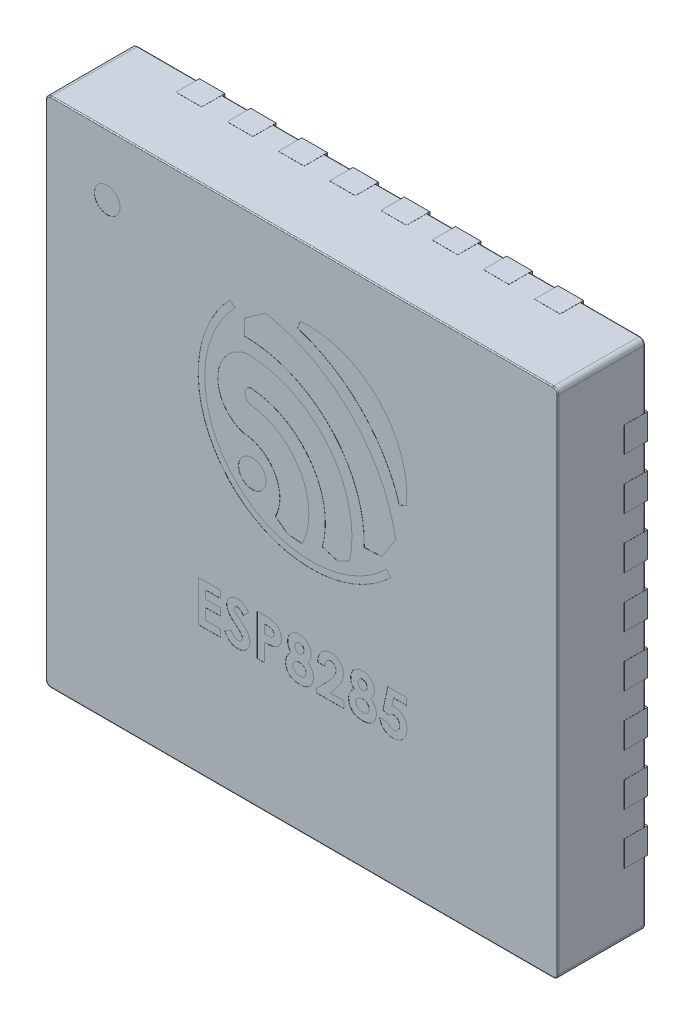
from build123d import *

# Parameters (mm, degrees)
SKETCH1_W                = 5
SKETCH1_H                = 5
BOSS_EXTRUDE1_DEPTH      = 0.85
FILLET1_R                = 0.05
FILLET2_R                = 0.01
BOSS_EXTRUDE2_DEPTH      = 0.025
BOSS_EXTRUDE2_DEPTH_BACK = 0.203
SKETCH2_W                = 0.25
SKETCH2_H                = 0.4
SKETCH2_W_2              = 0.4
SKETCH2_H_2              = 0.25
SKETCH3_R                = 0.125
SKETCH3_R_2              = 0.134340001
CUT_EXTRUDE1_DEPTH       = 0.001
BODY_MOVE_COPY1_ANGLE    = 180


with BuildPart() as part:
    # Sketch1 → Boss-Extrude1 (new body)
    with BuildSketch(Plane(origin=(0, 0, 0), x_dir=(1, 0, 0), z_dir=(0, 1, 0))):
        Rectangle(SKETCH1_W, SKETCH1_H)
    extrude(amount=BOSS_EXTRUDE1_DEPTH)

    # Fillet1
    fillet1_edges = [part.edges().sort_by_distance(p)[0] for p in [
        (2.5, 0.425, 2.5),
        (-2.5, 0.425, 2.5),
        (-2.5, 0.425, -2.5),
        (2.5, 0.425, -2.5),
    ]]
    fillet(fillet1_edges, radius=FILLET1_R)

    # Fillet2
    fillet2_edges = [part.edges().sort_by_distance(p)[0] for p in [
        (0, 0, -2.5),
        (0, 0.85, -2.5),
        (2.5, 0, 0),
        (0, 0, 2.5),
        (-2.5, 0, 0),
        (-2.485355339, 0, -2.485355339),
        (-2.485355339, 0, 2.485355339),
        (2.485355339, 0, 2.485355339),
        (2.485355339, 0, -2.485355339),
        (2.5, 0.85, 0),
        (-2.5, 0.85, 0),
        (0, 0.85, 2.5),
        (-2.485355339, 0.85, -2.485355339),
        (-2.485355339, 0.85, 2.485355339),
        (2.485355339, 0.85, 2.485355339),
        (2.485355339, 0.85, -2.485355339),
    ]]
    fillet(fillet2_edges, radius=FILLET2_R)

    # Sketch2 → Boss-Extrude2 (add, two sides: drawn at the far end of the back side and taken through both)
    with BuildSketch(Plane.XZ.offset(-BOSS_EXTRUDE2_DEPTH_BACK)):
        with BuildLine():
            Line((1.55, 1.85), (1.85, 1.55))
            Line((1.85, 1.55), (1.85, -1.8))
            ThreePointArc((1.85, -1.8), (1.835355339, -1.835355339), (1.8, -1.85))
            Line((1.8, -1.85), (-1.8, -1.85))
            ThreePointArc((-1.8, -1.85), (-1.835355339, -1.835355339), (-1.85, -1.8))
            Line((-1.85, -1.8), (-1.85, 1.8))
            ThreePointArc((-1.85, 1.8), (-1.835355339, 1.835355339), (-1.8, 1.85))
            Line((-1.8, 1.85), (1.55, 1.85))
        make_face()
        with Locations((-0.25, 2.301)):
            Rectangle(SKETCH2_W, SKETCH2_H)
        with Locations((-0.75, 2.301)):
            Rectangle(SKETCH2_W, SKETCH2_H)
        with Locations((-1.25, 2.301)):
            Rectangle(SKETCH2_W, SKETCH2_H)
        with Locations((-1.75, 2.301)):
            Rectangle(SKETCH2_W, SKETCH2_H)
        with Locations((1.75, 2.301)):
            Rectangle(SKETCH2_W, SKETCH2_H)
        with Locations((1.25, 2.301)):
            Rectangle(SKETCH2_W, SKETCH2_H)
        with Locations((0.75, 2.301)):
            Rectangle(SKETCH2_W, SKETCH2_H)
        with Locations((0.25, 2.301)):
            Rectangle(SKETCH2_W, SKETCH2_H)
        with Locations((0.25, -2.301)):
            Rectangle(SKETCH2_W, SKETCH2_H)
        with Locations((0.75, -2.301)):
            Rectangle(SKETCH2_W, SKETCH2_H)
        with Locations((1.25, -2.301)):
            Rectangle(SKETCH2_W, SKETCH2_H)
        with Locations((1.75, -2.301)):
            Rectangle(SKETCH2_W, SKETCH2_H)
        with Locations((-1.75, -2.301)):
            Rectangle(SKETCH2_W, SKETCH2_H)
        with Locations((-1.25, -2.301)):
            Rectangle(SKETCH2_W, SKETCH2_H)
        with Locations((-0.75, -2.301)):
            Rectangle(SKETCH2_W, SKETCH2_H)
        with Locations((-0.25, -2.301)):
            Rectangle(SKETCH2_W, SKETCH2_H)
        with Locations((2.301, 0.25)):
            Rectangle(SKETCH2_W_2, SKETCH2_H_2)
        with Locations((2.301, 0.75)):
            Rectangle(SKETCH2_W_2, SKETCH2_H_2)
        with Locations((2.301, 1.25)):
            Rectangle(SKETCH2_W_2, SKETCH2_H_2)
        with Locations((2.301, 1.75)):
            Rectangle(SKETCH2_W_2, SKETCH2_H_2)
        with Locations((2.301, -1.75)):
            Rectangle(SKETCH2_W_2, SKETCH2_H_2)
        with Locations((2.301, -1.25)):
            Rectangle(SKETCH2_W_2, SKETCH2_H_2)
        with Locations((2.301, -0.75)):
            Rectangle(SKETCH2_W_2, SKETCH2_H_2)
        with Locations((2.301, -0.25)):
            Rectangle(SKETCH2_W_2, SKETCH2_H_2)
        with Locations((-2.301, -0.25)):
            Rectangle(SKETCH2_W_2, SKETCH2_H_2)
        with Locations((-2.301, -0.75)):
            Rectangle(SKETCH2_W_2, SKETCH2_H_2)
        with Locations((-2.301, -1.25)):
            Rectangle(SKETCH2_W_2, SKETCH2_H_2)
        with Locations((-2.301, -1.75)):
            Rectangle(SKETCH2_W_2, SKETCH2_H_2)
        with Locations((-2.301, 1.75)):
            Rectangle(SKETCH2_W_2, SKETCH2_H_2)
        with Locations((-2.301, 1.25)):
            Rectangle(SKETCH2_W_2, SKETCH2_H_2)
        with Locations((-2.301, 0.75)):
            Rectangle(SKETCH2_W_2, SKETCH2_H_2)
        with Locations((-2.301, 0.25)):
            Rectangle(SKETCH2_W_2, SKETCH2_H_2)
    extrude(amount=BOSS_EXTRUDE2_DEPTH + BOSS_EXTRUDE2_DEPTH_BACK)

    # Sketch3 → Cut-Extrude1 (cut)
    # profile 1 of 13: a face of its own
    with BuildSketch(Plane(origin=(0, 0.85, 0), x_dir=(1, 0, 0), z_dir=(0, 1, 0))):
        with Locations(Location((1.9, -1.9, 0), (0, 0, 270))):
            Circle(SKETCH3_R)
    # profile 2 of 13: a face of its own
    with BuildSketch(Plane(origin=(0, 0.85, 0), x_dir=(1, 0, 0), z_dir=(0, 1, 0))):
        with Locations(Location((0.483594139, -0.295042575, 0), (0, 0, 270))):
            Circle(SKETCH3_R_2)
    # profile 3 of 13: a face of its own
    with BuildSketch(Plane(origin=(0, 0.85, 0), x_dir=(1, 0, 0), z_dir=(0, 1, 0))):
        with BuildLine():
            Line((-0.951785861, -0.747131021), (-1.020815861, -0.776531021))
            ThreePointArc((-1.020815861, -0.776531021), (-0.744879335, -1.538615836), (0.015772809, -1.818477493))
            Line((0.015772809, -1.818477493), (0.042084139, -1.745141021))
            ThreePointArc((0.042084139, -1.745141021), (-0.579273267, -1.370042291), (-0.951785861, -0.747131021))
        make_face()
    # profile 4 of 13: a face of its own
    with BuildSketch(Plane(origin=(0, 0.85, 0), x_dir=(1, 0, 0), z_dir=(0, 1, 0))):
        with BuildLine():
            Line((-0.608885862, -0.217240217), (-0.779015862, -0.224530217))
            Line((-0.779015862, -0.224530217), (-0.916505862, -0.434440217))
            ThreePointArc((-0.916505862, -0.434440217), (-0.482429799, -1.275536784), (0.355366094, -1.715949664))
            Line((0.355366094, -1.715949664), (0.561766094, -1.571139664))
            Line((0.561766094, -1.571139664), (0.561766094, -1.419009664))
            ThreePointArc((0.561766094, -1.419009664), (-0.277433802, -1.065425286), (-0.608885862, -0.217240217))
        make_face()
    # profile 5 of 13: a face of its own
    with BuildSketch(Plane(origin=(0, 0.85, 0), x_dir=(1, 0, 0), z_dir=(0, 1, 0))):
        with BuildLine():
            Line((0.652194139, -1.611641021), (0.700284139, -1.654181021))
            ThreePointArc((0.700284139, -1.654181021), (0.685311706, -0.099263955), (-0.869668762, -0.094067666))
            Line((-0.869668762, -0.094067666), (-0.826901773, -0.141962742))
            ThreePointArc((-0.826901773, -0.141962742), (0.64006638, -0.144720408), (0.652194139, -1.611641021))
        make_face()
    # profile 6 of 13: a face of its own
    with BuildSketch(Plane(origin=(0, 0.85, 0), x_dir=(1, 0, 0), z_dir=(0, 1, 0))):
        with BuildLine():
            Line((0.257726542, -0.047166837), (0.139346542, 0.042413163))
            Line((0.139346542, 0.042413163), (-0.002793458, 0.054923163))
            ThreePointArc((-0.002793458, 0.054923163), (0.010161928, -0.539574072), (0.504116848, -0.870638026))
            ThreePointArc((0.504116848, -0.870638026), (0.554404737, -0.94213728), (0.501462863, -1.011694256))
            ThreePointArc((0.501462863, -1.011694256), (-0.086844469, -0.682432252), (-0.198992375, -0.017645195))
            Line((-0.198992375, -0.017645195), (-0.349232375, 0.027084805))
            Line((-0.349232375, 0.027084805), (-0.466280352, -0.031499116))
            ThreePointArc((-0.466280352, -0.031499116), (-0.259791749, -0.898754897), (0.544527625, -1.283255195))
            ThreePointArc((0.544527625, -1.283255195), (0.820500189, -0.950984657), (0.574016431, -0.596287147))
            ThreePointArc((0.574016431, -0.596287147), (0.26490491, -0.408682802), (0.257726542, -0.047166837))
        make_face()
    # profile 7 of 13: a face of its own
    with BuildSketch(Plane(origin=(0, 0.85, 0), x_dir=(1, 0, 0), z_dir=(0, 1, 0))):
        with BuildLine():
            Line((-0.83838141, 0.845), (-1.020512821, 0.845))
            Line((-1.020512821, 0.845), (-1.020512821, 0.911666667))
            Line((-1.020512821, 0.911666667), (-0.895272436, 0.911666667))
            Line((-0.895272436, 0.911666667), (-0.879647436, 0.987307692))
            add(Edge.make_bspline(
                [(-0.879647436, 0.987307692), (-0.88177626, 0.986712941), (-0.886000031, 0.985532903), (-0.892330873, 0.984388808), (-0.898458165, 0.983606591), (-0.902454988, 0.983509136), (-0.904407051, 0.983461538)],
                knots=[0, 0, 0, 0, 1.054652254, 2.092520994, 3.068380062, 4, 4, 4, 4], degree=3))
            add(Edge.make_bspline(
                [(-0.904407051, 0.983461538), (-0.908660347, 0.983559), (-0.91704453, 0.983751119), (-0.929309526, 0.985574952), (-0.941053983, 0.988447434), (-0.952241964, 0.992544185), (-0.962862539, 0.997876214), (-0.972928581, 1.004326473), (-0.982452446, 1.011906292), (-0.991264949, 1.020620418), (-0.999362245, 1.030188725), (-1.006402382, 1.040537861), (-1.012415099, 1.051520258), (-1.017197406, 1.063204183), (-1.02097201, 1.075516251), (-1.023699623, 1.088464354), (-1.025312597, 1.102063837), (-1.025530097, 1.111341792), (-1.025641026, 1.116073718)],
                knots=[0, 0, 0, 0, 1.01440847, 1.999622559, 2.951875003, 3.895578053, 4.836219714, 5.782137149, 6.743708247, 7.735272588, 8.734977101, 9.730283169, 10.717124674, 11.717316708, 12.737475749, 13.78628267, 14.87096371, 16, 16, 16, 16], degree=3))
            add(Edge.make_bspline(
                [(-1.025641026, 1.116073718), (-1.025506164, 1.1208596), (-1.025240043, 1.130303544), (-1.023484912, 1.144185388), (-1.020439256, 1.15750513), (-1.016082444, 1.170182129), (-1.010584492, 1.182309229), (-1.003949103, 1.193901185), (-0.995927975, 1.204828892), (-0.98684947, 1.215087044), (-0.976943946, 1.224470899), (-0.966369862, 1.232704055), (-0.95530596, 1.239754789), (-0.943595375, 1.245346854), (-0.931417287, 1.249793468), (-0.9187294, 1.253023543), (-0.905476992, 1.254877383), (-0.89648007, 1.25512868), (-0.891907051, 1.25525641)],
                knots=[0, 0, 0, 0, 1.068252361, 2.107974174, 3.117445057, 4.112928197, 5.094821713, 6.085741881, 7.08864209, 8.115013732, 9.139860459, 10.12970393, 11.102304324, 12.062250553, 13.020362151, 13.992066755, 14.979393365, 16, 16, 16, 16], degree=3))
            add(Edge.make_bspline(
                [(-0.891907051, 1.25525641), (-0.887818349, 1.255148471), (-0.879754573, 1.254935592), (-0.867858065, 1.253717076), (-0.856448403, 1.251297116), (-0.845413093, 1.248258926), (-0.834904708, 1.244070952), (-0.824706707, 1.23925828), (-0.815126084, 1.233216062), (-0.805890658, 1.226559679), (-0.797355469, 1.219000087), (-0.789430795, 1.210831225), (-0.782418084, 1.201900397), (-0.776056067, 1.192381181), (-0.770690412, 1.182095836), (-0.765893828, 1.171229372), (-0.761975299, 1.159659475), (-0.759985537, 1.151639686), (-0.758974359, 1.147564103)],
                knots=[0, 0, 0, 0, 1.055144606, 2.080965977, 3.079696235, 4.061281178, 5.030010203, 5.994686618, 6.966205752, 7.947572972, 8.929036963, 9.903776773, 10.879904045, 11.854643856, 12.853445432, 13.868704235, 14.916895142, 16, 16, 16, 16], degree=3))
            Line((-0.758974359, 1.147564103), (-0.841025641, 1.147564103))
            add(Edge.make_bspline(
                [(-0.841025641, 1.147564103), (-0.842524814, 1.150389398), (-0.845438284, 1.155880036), (-0.850993058, 1.163153038), (-0.857167865, 1.169421519), (-0.864126829, 1.174451051), (-0.871500355, 1.17848231), (-0.879304513, 1.181440187), (-0.887533098, 1.183139553), (-0.893154795, 1.183353501), (-0.89599359, 1.183461538)],
                knots=[0, 0, 0, 0, 1.105237818, 2.14790357, 3.154462025, 4.139874369, 5.10774607, 6.055457142, 7.018062016, 8, 8, 8, 8], degree=3))
            add(Edge.make_bspline(
                [(-0.89599359, 1.183461538), (-0.897972124, 1.183387072), (-0.901864924, 1.183240559), (-0.907600617, 1.182466057), (-0.91307455, 1.180997261), (-0.918332354, 1.178969732), (-0.923389632, 1.176407603), (-0.928220909, 1.173259588), (-0.932801971, 1.169545491), (-0.937117552, 1.165325461), (-0.941012783, 1.160608844), (-0.944458338, 1.15557385), (-0.9474058, 1.150224864), (-0.949696857, 1.144502914), (-0.951545672, 1.138471607), (-0.952915247, 1.13212335), (-0.95373179, 1.125443552), (-0.953807522, 1.12088372), (-0.953846154, 1.118557692)],
                knots=[0, 0, 0, 0, 0.978584799, 1.925382083, 2.854237347, 3.773848163, 4.706917643, 5.651871472, 6.619075428, 7.618203006, 8.630937754, 9.638147826, 10.630884984, 11.643619732, 12.679505692, 13.746568031, 14.850495961, 16, 16, 16, 16], degree=3))
            add(Edge.make_bspline(
                [(-0.953846154, 1.118557692), (-0.953813736, 1.116283922), (-0.953750588, 1.111854822), (-0.952857302, 1.105386754), (-0.951737945, 1.099194807), (-0.949928463, 1.093336926), (-0.947720773, 1.087747649), (-0.944834581, 1.082556685), (-0.941701748, 1.077525758), (-0.937885843, 1.073021272), (-0.933854546, 1.068850044), (-0.929504374, 1.065222008), (-0.924931675, 1.062167843), (-0.920141235, 1.059672883), (-0.915177905, 1.057605605), (-0.909929455, 1.056320813), (-0.904523634, 1.055340153), (-0.90083276, 1.055284615), (-0.898958333, 1.05525641)],
                knots=[0, 0, 0, 0, 1.166510573, 2.272258428, 3.34817395, 4.393855846, 5.415148486, 6.427654656, 7.43960333, 8.452852352, 9.451798603, 10.415864797, 11.355425197, 12.269514664, 13.186377996, 14.107845883, 15.039060727, 16, 16, 16, 16], degree=3))
            add(Edge.make_bspline(
                [(-0.898958333, 1.05525641), (-0.896921904, 1.055331554), (-0.892840464, 1.055482158), (-0.886797515, 1.056771985), (-0.880774145, 1.058681063), (-0.874848715, 1.061531644), (-0.868965498, 1.0651891), (-0.863114367, 1.069607945), (-0.85731899, 1.074858809), (-0.853657188, 1.078785767), (-0.851762821, 1.080817308)],
                knots=[0, 0, 0, 0, 0.882519632, 1.768758668, 2.670168731, 3.618680561, 4.612333577, 5.671392632, 6.795336641, 8, 8, 8, 8], degree=3))
            Line((-0.851762821, 1.080817308), (-0.791346154, 1.066955128))
            Line((-0.791346154, 1.066955128), (-0.83838141, 0.845))
        make_face()
    # profile 8 of 13: a face of its own
    with BuildSketch(Plane(origin=(0, 0.85, 0), x_dir=(1, 0, 0), z_dir=(0, 1, 0))):
        with BuildLine():
            add(Edge.make_bspline(
                [(-0.673397436, 1.029615385), (-0.677592676, 1.032611819), (-0.685896776, 1.038542989), (-0.696835756, 1.049166136), (-0.706319304, 1.060978078), (-0.714210884, 1.073940436), (-0.720515406, 1.087813959), (-0.724848014, 1.102411983), (-0.727745214, 1.117508649), (-0.728050699, 1.127785556), (-0.728205128, 1.132980769)],
                knots=[0, 0, 0, 0, 1.013470425, 2.00607327, 2.989559212, 3.987547927, 4.985093546, 5.979490292, 6.978585884, 8, 8, 8, 8], degree=3))
            add(Edge.make_bspline(
                [(-0.728205128, 1.132980769), (-0.728015488, 1.138605423), (-0.727639362, 1.149761203), (-0.72430566, 1.166119166), (-0.71898142, 1.181819559), (-0.711636537, 1.196676855), (-0.702469997, 1.210281748), (-0.69184817, 1.222422273), (-0.679612501, 1.232562724), (-0.668312397, 1.239541116), (-0.658518136, 1.244068465), (-0.650677926, 1.247159249), (-0.642264081, 1.249595539), (-0.633416974, 1.251691005), (-0.624044292, 1.253262057), (-0.614238307, 1.254498783), (-0.603907086, 1.255098542), (-0.596875572, 1.255202891), (-0.593269231, 1.25525641)],
                knots=[0, 0, 0, 0, 1.313633616, 2.605423678, 3.884827599, 5.180399172, 6.467003699, 7.709825993, 8.937691468, 10.168030689, 10.802071053, 11.45831639, 12.135866991, 12.84764728, 13.582572811, 14.35620613, 15.156926628, 16, 16, 16, 16], degree=3))
            add(Edge.make_bspline(
                [(-0.593269231, 1.25525641), (-0.589422446, 1.255203935), (-0.581910435, 1.255101461), (-0.570943405, 1.254489406), (-0.560602554, 1.253339218), (-0.550841027, 1.251892113), (-0.541748344, 1.249743212), (-0.533203708, 1.247407034), (-0.525299549, 1.244504849), (-0.515637693, 1.240028681), (-0.504438182, 1.233334421), (-0.492485395, 1.223326268), (-0.481835419, 1.211591801), (-0.47291586, 1.198046978), (-0.465483483, 1.183267583), (-0.460179218, 1.167327916), (-0.456984356, 1.150443239), (-0.456603901, 1.138870869), (-0.456410256, 1.132980769)],
                knots=[0, 0, 0, 0, 0.887187828, 1.732502891, 2.531768656, 3.28622382, 4.00645991, 4.68503301, 5.328123524, 5.945476897, 7.13918604, 8.324554323, 9.528234031, 10.780485522, 12.053158567, 13.332907357, 14.642504384, 16, 16, 16, 16], degree=3))
            add(Edge.make_bspline(
                [(-0.456410256, 1.132980769), (-0.456542381, 1.1278403), (-0.456802174, 1.11773271), (-0.459504282, 1.102980157), (-0.463624036, 1.088870262), (-0.469645079, 1.075532904), (-0.477204439, 1.062806695), (-0.486620249, 1.050952752), (-0.497571185, 1.039680894), (-0.505904888, 1.033026207), (-0.510176282, 1.029615385)],
                knots=[0, 0, 0, 0, 1.017680362, 2.001042016, 2.962316111, 3.924347734, 4.892953533, 5.888308623, 6.917664266, 8, 8, 8, 8], degree=3))
            add(Edge.make_bspline(
                [(-0.510176282, 1.029615385), (-0.507528109, 1.026562761), (-0.502314655, 1.020553065), (-0.495585881, 1.010872929), (-0.489843763, 1.00091206), (-0.485210311, 0.99061154), (-0.481484993, 0.980090117), (-0.47880531, 0.969283041), (-0.477281406, 0.958157926), (-0.477043329, 0.950640164), (-0.476923077, 0.946842949)],
                knots=[0, 0, 0, 0, 1.06167017, 2.090108827, 3.093337593, 4.079993162, 5.054811602, 6.023746282, 7.001795783, 8, 8, 8, 8], degree=3))
            add(Edge.make_bspline(
                [(-0.476923077, 0.946842949), (-0.477081268, 0.941702255), (-0.477393373, 0.931559864), (-0.480208687, 0.916714316), (-0.484778775, 0.902558838), (-0.491226001, 0.889279591), (-0.499159864, 0.877001848), (-0.508764714, 0.866148286), (-0.519757362, 0.856664209), (-0.532202452, 0.848746049), (-0.545880528, 0.842489072), (-0.560641334, 0.837991374), (-0.576416771, 0.835199163), (-0.587301225, 0.834897758), (-0.59286859, 0.83474359)],
                knots=[0, 0, 0, 0, 1.022461855, 2.017277858, 2.995792987, 3.975491763, 4.947267477, 5.896545572, 6.850353789, 7.828175386, 8.82259352, 9.83498435, 10.892601059, 12, 12, 12, 12], degree=3))
            add(Edge.make_bspline(
                [(-0.59286859, 0.83474359), (-0.598355802, 0.834897561), (-0.609054718, 0.835197774), (-0.624577247, 0.837982117), (-0.639066056, 0.84257513), (-0.652501229, 0.848914793), (-0.664773175, 0.856924995), (-0.675570704, 0.86669615), (-0.685136402, 0.87783403), (-0.693160955, 0.89040223), (-0.6996184, 0.903943454), (-0.704335579, 0.918171139), (-0.707102014, 0.93292693), (-0.707494756, 0.942932094), (-0.707692308, 0.947964744)],
                knots=[0, 0, 0, 0, 1.094374825, 2.133801765, 3.135215957, 4.120034135, 5.089936793, 6.048819145, 7.016727444, 8.011879177, 9.015716645, 10.003559944, 10.995780443, 12, 12, 12, 12], degree=3))
            add(Edge.make_bspline(
                [(-0.707692308, 0.947964744), (-0.707596547, 0.951521243), (-0.707408623, 0.958500608), (-0.706024248, 0.96878469), (-0.70367955, 0.978646438), (-0.700454873, 0.988362906), (-0.695784749, 0.998063029), (-0.689814827, 1.008215217), (-0.682223326, 1.018839522), (-0.676432055, 1.025910304), (-0.673397436, 1.029615385)],
                knots=[0, 0, 0, 0, 0.940860718, 1.84636882, 2.739437118, 3.619946589, 4.54937856, 5.582024627, 6.73298378, 8, 8, 8, 8], degree=3))
        make_face()
        with BuildLine():
            add(Edge.make_bspline(
                [(-0.591105769, 0.906538462), (-0.588150417, 0.90668361), (-0.582375965, 0.906967214), (-0.574174848, 0.909438485), (-0.566788394, 0.913488143), (-0.560412613, 0.919111565), (-0.555232467, 0.92600902), (-0.551359515, 0.933870968), (-0.549084691, 0.942657059), (-0.548842573, 0.948806082), (-0.548717949, 0.951971154)],
                knots=[0, 0, 0, 0, 1.017635784, 1.98835473, 2.924394675, 3.903775679, 4.896969949, 5.881752986, 6.909679918, 8, 8, 8, 8], degree=3))
            add(Edge.make_bspline(
                [(-0.548717949, 0.951971154), (-0.548873326, 0.955162741), (-0.549176714, 0.961394622), (-0.55151, 0.970368411), (-0.555633629, 0.978449233), (-0.561164842, 0.985524795), (-0.567714192, 0.991500555), (-0.575313873, 0.995745402), (-0.583631692, 0.998460232), (-0.589481915, 0.99871574), (-0.592467949, 0.998846154)],
                knots=[0, 0, 0, 0, 1.071109905, 2.091445327, 3.086230388, 4.096303754, 5.093673306, 6.041538876, 7.0003745, 8, 8, 8, 8], degree=3))
            add(Edge.make_bspline(
                [(-0.592467949, 0.998846154), (-0.595503861, 0.998707864), (-0.601418389, 0.998438451), (-0.609862328, 0.995872311), (-0.617390112, 0.991577831), (-0.623961308, 0.985817209), (-0.62928278, 0.978682386), (-0.633189826, 0.970472411), (-0.635440158, 0.961223234), (-0.635741282, 0.954761257), (-0.635897436, 0.951410256)],
                knots=[0, 0, 0, 0, 1.008985882, 1.965693801, 2.905634363, 3.876216071, 4.854591133, 5.849205062, 6.884658104, 8, 8, 8, 8], degree=3))
            add(Edge.make_bspline(
                [(-0.635897436, 0.951410256), (-0.635748937, 0.948243415), (-0.635461422, 0.942111971), (-0.6330876, 0.933383369), (-0.629161325, 0.925589081), (-0.623778824, 0.91882569), (-0.617080668, 0.913344456), (-0.609289602, 0.909318343), (-0.600479891, 0.906982051), (-0.594298142, 0.906689527), (-0.591105769, 0.906538462)],
                knots=[0, 0, 0, 0, 1.066147256, 2.064208482, 3.022454516, 3.989792431, 4.955788801, 5.918128389, 6.924881755, 8, 8, 8, 8], degree=3))
        make_face(mode=Mode.SUBTRACT)
        with BuildLine():
            add(Edge.make_bspline(
                [(-0.593429487, 1.070641026), (-0.591182918, 1.070677485), (-0.586754959, 1.070749345), (-0.580250229, 1.071609285), (-0.573982478, 1.072830096), (-0.568061528, 1.074732095), (-0.562330518, 1.076953987), (-0.556934117, 1.07985548), (-0.551779862, 1.083225946), (-0.546978973, 1.087066542), (-0.542638736, 1.09127786), (-0.538726762, 1.095671161), (-0.535529191, 1.100358767), (-0.532866399, 1.105185175), (-0.530726825, 1.110188552), (-0.529312406, 1.115451314), (-0.528401718, 1.12090337), (-0.528271044, 1.12461709), (-0.528205128, 1.126490385)],
                knots=[0, 0, 0, 0, 1.129662435, 2.226550525, 3.296682235, 4.33815786, 5.351414921, 6.385493299, 7.41431807, 8.4469981, 9.473537958, 10.454642902, 11.401552439, 12.321859429, 13.225429467, 14.131893492, 15.057679712, 16, 16, 16, 16], degree=3))
            add(Edge.make_bspline(
                [(-0.528205128, 1.126490385), (-0.528236692, 1.12844397), (-0.528299295, 1.132318664), (-0.529238272, 1.137975416), (-0.530601118, 1.143425875), (-0.532479583, 1.148654612), (-0.535140688, 1.153555788), (-0.538156563, 1.158320725), (-0.54180017, 1.162820064), (-0.545937454, 1.167025008), (-0.550501099, 1.170897204), (-0.555490446, 1.174244406), (-0.560800665, 1.177178831), (-0.566509625, 1.179488347), (-0.572558791, 1.18124093), (-0.578911482, 1.182510037), (-0.585607639, 1.18335612), (-0.590194948, 1.183425797), (-0.592548077, 1.183461538)],
                knots=[0, 0, 0, 0, 0.974019005, 1.931846162, 2.853358636, 3.777086404, 4.695411081, 5.630991801, 6.588726176, 7.578582455, 8.572023234, 9.570371685, 10.572628972, 11.595075622, 12.6370648, 13.711634473, 14.826148828, 16, 16, 16, 16], degree=3))
            add(Edge.make_bspline(
                [(-0.592548077, 1.183461538), (-0.594927221, 1.183418414), (-0.59956342, 1.183334377), (-0.606340609, 1.182591652), (-0.612750635, 1.181413169), (-0.618785803, 1.179727641), (-0.624469071, 1.177568491), (-0.62972372, 1.174820036), (-0.634671482, 1.171706273), (-0.639146983, 1.168064773), (-0.643224496, 1.164135787), (-0.646687448, 1.159775774), (-0.649801146, 1.155262206), (-0.652143877, 1.150303803), (-0.654150293, 1.145188532), (-0.655342805, 1.139721727), (-0.656333936, 1.134031307), (-0.656384448, 1.130101054), (-0.656410256, 1.128092949)],
                knots=[0, 0, 0, 0, 1.200730299, 2.339843079, 3.437336227, 4.487507367, 5.49914389, 6.500211663, 7.47645343, 8.445123332, 9.408146062, 10.328401978, 11.252108805, 12.168702489, 13.09034032, 14.019150537, 14.98791428, 16, 16, 16, 16], degree=3))
            add(Edge.make_bspline(
                [(-0.656410256, 1.128092949), (-0.656336911, 1.126087703), (-0.656193547, 1.122168144), (-0.655410185, 1.116379468), (-0.653937166, 1.110893739), (-0.652021602, 1.105574129), (-0.649436598, 1.100579318), (-0.646381137, 1.095756379), (-0.642646862, 1.091312179), (-0.638518993, 1.087046148), (-0.633879143, 1.083229016), (-0.628900482, 1.079881186), (-0.623715293, 1.076935125), (-0.618156803, 1.074735287), (-0.612398445, 1.072829204), (-0.606289108, 1.07160935), (-0.599944399, 1.070749148), (-0.595622726, 1.070677425), (-0.593429487, 1.070641026)],
                knots=[0, 0, 0, 0, 1.011607766, 1.977342622, 2.937803287, 3.871057497, 4.822789971, 5.768019373, 6.744124207, 7.744188914, 8.758214762, 9.766859222, 10.76764927, 11.758144632, 12.776187854, 13.822267547, 14.894806271, 16, 16, 16, 16], degree=3))
        make_face(mode=Mode.SUBTRACT)
    # profile 9 of 13: a face of its own
    with BuildSketch(Plane(origin=(0, 0.85, 0), x_dir=(1, 0, 0), z_dir=(0, 1, 0))):
        with BuildLine():
            Line((-0.225641026, 0.978333333), (-0.153846154, 0.978333333))
            add(Edge.make_bspline(
                [(-0.153846154, 0.978333333), (-0.154156103, 0.972902374), (-0.154761725, 0.962290606), (-0.15717338, 0.946877627), (-0.160396612, 0.932310492), (-0.16473516, 0.918632998), (-0.170079057, 0.905839397), (-0.176561304, 0.893972067), (-0.183988365, 0.882945974), (-0.192509946, 0.872954494), (-0.201780198, 0.863971849), (-0.211775355, 0.856118985), (-0.222467024, 0.849545111), (-0.233783712, 0.844152532), (-0.24568097, 0.839837774), (-0.258279001, 0.836954528), (-0.271466645, 0.835001543), (-0.280494735, 0.834830677), (-0.285096154, 0.83474359)],
                knots=[0, 0, 0, 0, 1.198928049, 2.342633425, 3.435730849, 4.486331048, 5.502589352, 6.488331875, 7.46361919, 8.428949135, 9.378681775, 10.305958057, 11.226249248, 12.140413166, 13.066341608, 14.010670971, 14.986082777, 16, 16, 16, 16], degree=3))
            add(Edge.make_bspline(
                [(-0.285096154, 0.83474359), (-0.290746742, 0.834908269), (-0.301782862, 0.835229903), (-0.317768007, 0.838326648), (-0.332792111, 0.843096849), (-0.346706708, 0.84995776), (-0.359438867, 0.858648889), (-0.37083723, 0.869122818), (-0.380954112, 0.881251069), (-0.389455992, 0.894944996), (-0.396371101, 0.909496014), (-0.401363967, 0.924454365), (-0.404606915, 0.939518448), (-0.404955189, 0.949658233), (-0.405128205, 0.954695513)],
                knots=[0, 0, 0, 0, 1.075206757, 2.099977874, 3.089436832, 4.070080219, 5.043757236, 6.01602434, 7.009399377, 8.042659726, 9.078134622, 10.07077983, 11.041594984, 12, 12, 12, 12], degree=3))
            add(Edge.make_bspline(
                [(-0.405128205, 0.954695513), (-0.405061097, 0.957742592), (-0.404926024, 0.963875609), (-0.403986847, 0.97315637), (-0.402577896, 0.98260991), (-0.40045354, 0.992228123), (-0.397804296, 1.002013708), (-0.394590371, 1.01199594), (-0.390737262, 1.022118258), (-0.38630908, 1.032494456), (-0.381026886, 1.043158745), (-0.37487388, 1.054268824), (-0.367680281, 1.065855264), (-0.359516321, 1.077881992), (-0.350439508, 1.090442279), (-0.340311683, 1.103387367), (-0.329262559, 1.116863405), (-0.321418102, 1.125869628), (-0.317387821, 1.130496795)],
                knots=[0, 0, 0, 0, 0.728286467, 1.465860763, 2.227952348, 3.011875114, 3.818782069, 4.650637576, 5.517456182, 6.406927181, 7.346324104, 8.360844784, 9.441645378, 10.605053135, 11.834886952, 13.145197974, 14.533275831, 16, 16, 16, 16], degree=3))
            Line((-0.317387821, 1.130496795), (-0.275641026, 1.178333333))
            Line((-0.275641026, 1.178333333), (-0.41025641, 1.178333333))
            Line((-0.41025641, 1.178333333), (-0.41025641, 1.245))
            Line((-0.41025641, 1.245), (-0.143589744, 1.245))
            Line((-0.143589744, 1.245), (-0.143589744, 1.208621795))
            Line((-0.143589744, 1.208621795), (-0.262019231, 1.082580128))
            add(Edge.make_bspline(
                [(-0.262019231, 1.082580128), (-0.265448123, 1.07890349), (-0.272088871, 1.071782933), (-0.281537088, 1.061325039), (-0.290090037, 1.05140289), (-0.297556474, 1.041901421), (-0.304388141, 1.03314234), (-0.310103333, 1.024794519), (-0.315080564, 1.017093049), (-0.320279809, 1.007705263), (-0.325331012, 0.996593223), (-0.329962885, 0.983799609), (-0.33275803, 0.971563287), (-0.333146819, 0.963575561), (-0.333333333, 0.95974359)],
                knots=[0, 0, 0, 0, 1.246192343, 2.413505005, 3.49357156, 4.492416076, 5.408771964, 6.246246772, 6.999304986, 7.680960093, 8.904522682, 10.020616941, 11.0504258, 12, 12, 12, 12], degree=3))
            add(Edge.make_bspline(
                [(-0.333333333, 0.95974359), (-0.333196421, 0.956035218), (-0.332931131, 0.948849653), (-0.329943139, 0.938657963), (-0.325472364, 0.929360403), (-0.318981648, 0.921380503), (-0.311147519, 0.914765908), (-0.30204296, 0.909918813), (-0.291835136, 0.907069945), (-0.284686904, 0.906719), (-0.281009615, 0.906538462)],
                knots=[0, 0, 0, 0, 1.061596218, 2.057012874, 3.024113775, 4.006148568, 4.986025304, 5.949989669, 6.945406325, 8, 8, 8, 8], degree=3))
            add(Edge.make_bspline(
                [(-0.281009615, 0.906538462), (-0.279110256, 0.906605641), (-0.275371061, 0.906737894), (-0.269874738, 0.90761827), (-0.264644591, 0.90916984), (-0.259622406, 0.911248725), (-0.254861782, 0.914004302), (-0.250374726, 0.91740099), (-0.246113962, 0.921352471), (-0.242099031, 0.925846389), (-0.238444919, 0.930861604), (-0.235199351, 0.93635231), (-0.232515806, 0.942315101), (-0.230153115, 0.948671257), (-0.228330895, 0.955489049), (-0.227004093, 0.962727675), (-0.225995414, 0.970375356), (-0.225761304, 0.975632418), (-0.225641026, 0.978333333)],
                knots=[0, 0, 0, 0, 0.903469896, 1.778625579, 2.63899355, 3.493148037, 4.358286772, 5.247621495, 6.164656832, 7.118446693, 8.109501108, 9.111810964, 10.146451449, 11.215617525, 12.33435995, 13.498009769, 14.714554818, 16, 16, 16, 16], degree=3))
        make_face()
    # profile 10 of 13: a face of its own
    with BuildSketch(Plane(origin=(0, 0.85, 0), x_dir=(1, 0, 0), z_dir=(0, 1, 0))):
        with BuildLine():
            add(Edge.make_bspline(
                [(-0.058012821, 1.029615385), (-0.062208061, 1.032611819), (-0.070512161, 1.038542989), (-0.081451141, 1.049166136), (-0.090934689, 1.060978078), (-0.098826269, 1.073940436), (-0.10513079, 1.087813959), (-0.109463398, 1.102411983), (-0.112360599, 1.117508649), (-0.112666083, 1.127785556), (-0.112820513, 1.132980769)],
                knots=[0, 0, 0, 0, 1.013470425, 2.00607327, 2.989559212, 3.987547927, 4.985093546, 5.979490292, 6.978585884, 8, 8, 8, 8], degree=3))
            add(Edge.make_bspline(
                [(-0.112820513, 1.132980769), (-0.112630873, 1.138605423), (-0.112254747, 1.149761203), (-0.108921045, 1.166119166), (-0.103596804, 1.181819559), (-0.096251921, 1.196676855), (-0.087085382, 1.210281748), (-0.076463554, 1.222422273), (-0.064227885, 1.232562724), (-0.052927781, 1.239541116), (-0.04313352, 1.244068465), (-0.03529331, 1.247159249), (-0.026879466, 1.249595539), (-0.018032359, 1.251691005), (-0.008659677, 1.253262057), (0.001146308, 1.254498783), (0.01147753, 1.255098542), (0.018509043, 1.255202891), (0.022115385, 1.25525641)],
                knots=[0, 0, 0, 0, 1.313633616, 2.605423678, 3.884827599, 5.180399172, 6.467003699, 7.709825993, 8.937691468, 10.168030689, 10.802071053, 11.45831639, 12.135866991, 12.84764728, 13.582572811, 14.35620613, 15.156926628, 16, 16, 16, 16], degree=3))
            add(Edge.make_bspline(
                [(0.022115385, 1.25525641), (0.025962169, 1.255203935), (0.03347418, 1.255101461), (0.044441211, 1.254489406), (0.054782061, 1.253339218), (0.064543588, 1.251892113), (0.073636271, 1.249743212), (0.082180907, 1.247407034), (0.090085066, 1.244504849), (0.099746923, 1.240028681), (0.110946433, 1.233334421), (0.12289922, 1.223326268), (0.133549196, 1.211591801), (0.142468755, 1.198046978), (0.149901132, 1.183267583), (0.155205398, 1.167327916), (0.158400259, 1.150443239), (0.158780715, 1.138870869), (0.158974359, 1.132980769)],
                knots=[0, 0, 0, 0, 0.887187828, 1.732502891, 2.531768656, 3.28622382, 4.00645991, 4.68503301, 5.328123524, 5.945476897, 7.13918604, 8.324554323, 9.528234031, 10.780485522, 12.053158567, 13.332907357, 14.642504384, 16, 16, 16, 16], degree=3))
            add(Edge.make_bspline(
                [(0.158974359, 1.132980769), (0.158842235, 1.1278403), (0.158582442, 1.11773271), (0.155880333, 1.102980157), (0.151760579, 1.088870262), (0.145739537, 1.075532904), (0.138180177, 1.062806695), (0.128764367, 1.050952752), (0.117813431, 1.039680894), (0.109479727, 1.033026207), (0.105208333, 1.029615385)],
                knots=[0, 0, 0, 0, 1.017680362, 2.001042016, 2.962316111, 3.924347734, 4.892953533, 5.888308623, 6.917664266, 8, 8, 8, 8], degree=3))
            add(Edge.make_bspline(
                [(0.105208333, 1.029615385), (0.107856506, 1.026562761), (0.11306996, 1.020553065), (0.119798735, 1.010872929), (0.125540852, 1.00091206), (0.130174305, 0.99061154), (0.133899623, 0.980090117), (0.136579305, 0.969283041), (0.13810321, 0.958157926), (0.138341286, 0.950640164), (0.138461538, 0.946842949)],
                knots=[0, 0, 0, 0, 1.06167017, 2.090108827, 3.093337593, 4.079993162, 5.054811602, 6.023746282, 7.001795783, 8, 8, 8, 8], degree=3))
            add(Edge.make_bspline(
                [(0.138461538, 0.946842949), (0.138303347, 0.941702255), (0.137991242, 0.931559864), (0.135175929, 0.916714316), (0.13060584, 0.902558838), (0.124158615, 0.889279591), (0.116224752, 0.877001848), (0.106619901, 0.866148286), (0.095627254, 0.856664209), (0.083182163, 0.848746049), (0.069504088, 0.842489072), (0.054743281, 0.837991374), (0.038967844, 0.835199163), (0.028083391, 0.834897758), (0.022516026, 0.83474359)],
                knots=[0, 0, 0, 0, 1.022461855, 2.017277858, 2.995792987, 3.975491763, 4.947267477, 5.896545572, 6.850353789, 7.828175386, 8.82259352, 9.83498435, 10.892601059, 12, 12, 12, 12], degree=3))
            add(Edge.make_bspline(
                [(0.022516026, 0.83474359), (0.017028813, 0.834897561), (0.006329897, 0.835197774), (-0.009192632, 0.837982117), (-0.023681441, 0.84257513), (-0.037116614, 0.848914793), (-0.04938856, 0.856924995), (-0.060186088, 0.86669615), (-0.069751786, 0.87783403), (-0.07777634, 0.89040223), (-0.084233784, 0.903943454), (-0.088950964, 0.918171139), (-0.091717399, 0.93292693), (-0.092110141, 0.942932094), (-0.092307692, 0.947964744)],
                knots=[0, 0, 0, 0, 1.094374825, 2.133801765, 3.135215957, 4.120034135, 5.089936793, 6.048819145, 7.016727444, 8.011879177, 9.015716645, 10.003559944, 10.995780443, 12, 12, 12, 12], degree=3))
            add(Edge.make_bspline(
                [(-0.092307692, 0.947964744), (-0.092211932, 0.951521243), (-0.092024008, 0.958500608), (-0.090639633, 0.96878469), (-0.088294934, 0.978646438), (-0.085070258, 0.988362906), (-0.080400134, 0.998063029), (-0.074430211, 1.008215217), (-0.06683871, 1.018839522), (-0.06104744, 1.025910304), (-0.058012821, 1.029615385)],
                knots=[0, 0, 0, 0, 0.940860718, 1.84636882, 2.739437118, 3.619946589, 4.54937856, 5.582024627, 6.73298378, 8, 8, 8, 8], degree=3))
        make_face()
        with BuildLine():
            add(Edge.make_bspline(
                [(0.024278846, 0.906538462), (0.027234199, 0.90668361), (0.03300865, 0.906967214), (0.041209768, 0.909438485), (0.048596222, 0.913488143), (0.054972003, 0.919111565), (0.060152148, 0.92600902), (0.0640251, 0.933870968), (0.066299924, 0.942657059), (0.066542042, 0.948806082), (0.066666667, 0.951971154)],
                knots=[0, 0, 0, 0, 1.017635784, 1.98835473, 2.924394675, 3.903775679, 4.896969949, 5.881752986, 6.909679918, 8, 8, 8, 8], degree=3))
            add(Edge.make_bspline(
                [(0.066666667, 0.951971154), (0.06651129, 0.955162741), (0.066207902, 0.961394622), (0.063874615, 0.970368411), (0.059750986, 0.978449233), (0.054219773, 0.985524795), (0.047670424, 0.991500555), (0.040070742, 0.995745402), (0.031752923, 0.998460232), (0.025902701, 0.99871574), (0.022916667, 0.998846154)],
                knots=[0, 0, 0, 0, 1.071109905, 2.091445327, 3.086230388, 4.096303754, 5.093673306, 6.041538876, 7.0003745, 8, 8, 8, 8], degree=3))
            add(Edge.make_bspline(
                [(0.022916667, 0.998846154), (0.019880754, 0.998707864), (0.013966227, 0.998438451), (0.005522288, 0.995872311), (-0.002005497, 0.991577831), (-0.008576693, 0.985817209), (-0.013898164, 0.978682386), (-0.017805211, 0.970472411), (-0.020055542, 0.961223234), (-0.020356666, 0.954761257), (-0.020512821, 0.951410256)],
                knots=[0, 0, 0, 0, 1.008985882, 1.965693801, 2.905634363, 3.876216071, 4.854591133, 5.849205062, 6.884658104, 8, 8, 8, 8], degree=3))
            add(Edge.make_bspline(
                [(-0.020512821, 0.951410256), (-0.020364321, 0.948243415), (-0.020076806, 0.942111971), (-0.017702985, 0.933383369), (-0.013776709, 0.925589081), (-0.008394209, 0.91882569), (-0.001696053, 0.913344456), (0.006095013, 0.909318343), (0.014904724, 0.906982051), (0.021086473, 0.906689527), (0.024278846, 0.906538462)],
                knots=[0, 0, 0, 0, 1.066147256, 2.064208482, 3.022454516, 3.989792431, 4.955788801, 5.918128389, 6.924881755, 8, 8, 8, 8], degree=3))
        make_face(mode=Mode.SUBTRACT)
        with BuildLine():
            add(Edge.make_bspline(
                [(0.021955128, 1.070641026), (0.024201697, 1.070677485), (0.028629657, 1.070749345), (0.035134386, 1.071609285), (0.041402137, 1.072830096), (0.047323088, 1.074732095), (0.053054097, 1.076953987), (0.058450498, 1.07985548), (0.063604753, 1.083225946), (0.068405642, 1.087066542), (0.072745879, 1.09127786), (0.076657854, 1.095671161), (0.079855424, 1.100358767), (0.082518217, 1.105185175), (0.084657791, 1.110188552), (0.086072209, 1.115451314), (0.086982898, 1.12090337), (0.087113572, 1.12461709), (0.087179487, 1.126490385)],
                knots=[0, 0, 0, 0, 1.129662435, 2.226550525, 3.296682235, 4.33815786, 5.351414921, 6.385493299, 7.41431807, 8.4469981, 9.473537958, 10.454642902, 11.401552439, 12.321859429, 13.225429467, 14.131893492, 15.057679712, 16, 16, 16, 16], degree=3))
            add(Edge.make_bspline(
                [(0.087179487, 1.126490385), (0.087147923, 1.12844397), (0.08708532, 1.132318664), (0.086146344, 1.137975416), (0.084783497, 1.143425875), (0.082905033, 1.148654612), (0.080243928, 1.153555788), (0.077228052, 1.158320725), (0.073584445, 1.162820064), (0.069447161, 1.167025008), (0.064883516, 1.170897204), (0.059894169, 1.174244406), (0.05458395, 1.177178831), (0.04887499, 1.179488347), (0.042825824, 1.18124093), (0.036473134, 1.182510037), (0.029776976, 1.18335612), (0.025189667, 1.183425797), (0.022836538, 1.183461538)],
                knots=[0, 0, 0, 0, 0.974019005, 1.931846162, 2.853358636, 3.777086404, 4.695411081, 5.630991801, 6.588726176, 7.578582455, 8.572023234, 9.570371685, 10.572628972, 11.595075622, 12.6370648, 13.711634473, 14.826148828, 16, 16, 16, 16], degree=3))
            add(Edge.make_bspline(
                [(0.022836538, 1.183461538), (0.020457394, 1.183418414), (0.015821195, 1.183334377), (0.009044007, 1.182591652), (0.002633981, 1.181413169), (-0.003401188, 1.179727641), (-0.009084456, 1.177568491), (-0.014339105, 1.174820036), (-0.019286866, 1.171706273), (-0.023762368, 1.168064773), (-0.02783988, 1.164135787), (-0.031302833, 1.159775774), (-0.03441653, 1.155262206), (-0.036759262, 1.150303803), (-0.038765677, 1.145188532), (-0.039958189, 1.139721727), (-0.04094932, 1.134031307), (-0.040999833, 1.130101054), (-0.041025641, 1.128092949)],
                knots=[0, 0, 0, 0, 1.200730299, 2.339843079, 3.437336227, 4.487507367, 5.49914389, 6.500211663, 7.47645343, 8.445123332, 9.408146062, 10.328401978, 11.252108805, 12.168702489, 13.09034032, 14.019150537, 14.98791428, 16, 16, 16, 16], degree=3))
            add(Edge.make_bspline(
                [(-0.041025641, 1.128092949), (-0.040952296, 1.126087703), (-0.040808932, 1.122168144), (-0.04002557, 1.116379468), (-0.03855255, 1.110893739), (-0.036636987, 1.105574129), (-0.034051983, 1.100579318), (-0.030996521, 1.095756379), (-0.027262246, 1.091312179), (-0.023134378, 1.087046148), (-0.018494528, 1.083229016), (-0.013515867, 1.079881186), (-0.008330677, 1.076935125), (-0.002772187, 1.074735287), (0.00298617, 1.072829204), (0.009095507, 1.07160935), (0.015440217, 1.070749148), (0.01976189, 1.070677425), (0.021955128, 1.070641026)],
                knots=[0, 0, 0, 0, 1.011607766, 1.977342622, 2.937803287, 3.871057497, 4.822789971, 5.768019373, 6.744124207, 7.744188914, 8.758214762, 9.766859222, 10.76764927, 11.758144632, 12.776187854, 13.822267547, 14.894806271, 16, 16, 16, 16], degree=3))
        make_face(mode=Mode.SUBTRACT)
    # profile 11 of 13: a face of its own
    with BuildSketch(Plane(origin=(0, 0.85, 0), x_dir=(1, 0, 0), z_dir=(0, 1, 0))):
        with BuildLine():
            Line((0.435897436, 0.845), (0.355769231, 0.845))
            add(Edge.make_bspline(
                [(0.355769231, 0.845), (0.350533758, 0.845023435), (0.340433433, 0.845068646), (0.325867934, 0.845616893), (0.312430546, 0.846599381), (0.300124365, 0.84781359), (0.288954424, 0.849515835), (0.27890682, 0.85146741), (0.269979194, 0.853844722), (0.262071756, 0.856667434), (0.254972896, 0.859992389), (0.248262979, 0.86354381), (0.242042993, 0.867753469), (0.23616691, 0.872317926), (0.230679181, 0.877332141), (0.225539139, 0.882776297), (0.220799712, 0.888729512), (0.216490616, 0.895150775), (0.212579453, 0.901909353), (0.209162968, 0.909020659), (0.206391562, 0.916495039), (0.204066738, 0.924284388), (0.202199405, 0.9323883), (0.200956452, 0.940856632), (0.200112175, 0.94963025), (0.200037679, 0.95560158), (0.2, 0.958621795)],
                knots=[0, 0, 0, 0, 1.698787518, 3.27731721, 4.728409951, 6.070286353, 7.288646904, 8.393455548, 9.389990496, 10.283725379, 11.113616976, 11.931887102, 12.744353494, 13.547053751, 14.344590688, 15.153907614, 15.974148981, 16.810666655, 17.660988447, 18.506082349, 19.367288142, 20.244738011, 21.142497992, 22.06302001, 23.020302899, 24, 24, 24, 24], degree=3))
            add(Edge.make_bspline(
                [(0.2, 0.958621795), (0.20005428, 0.961963083), (0.200160948, 0.968529125), (0.201214534, 0.978152487), (0.202996616, 0.987333736), (0.205382326, 0.996112095), (0.208494151, 1.004468359), (0.21239431, 1.012347634), (0.216855557, 1.019848654), (0.222122237, 1.026834224), (0.227941935, 1.033339904), (0.23420842, 1.039436491), (0.24110972, 1.044873405), (0.248399506, 1.049933305), (0.256286361, 1.054319194), (0.26453661, 1.058380345), (0.273359505, 1.061826603), (0.279499319, 1.063634623), (0.282612179, 1.064551282)],
                knots=[0, 0, 0, 0, 1.101767505, 2.165108537, 3.187936629, 4.183892551, 5.162396277, 6.123736501, 7.080098904, 8.036826416, 9.0040019, 9.957275584, 10.916231297, 11.898534744, 12.880877694, 13.889532316, 14.930001539, 16, 16, 16, 16], degree=3))
            add(Edge.make_bspline(
                [(0.282612179, 1.064551282), (0.284662719, 1.06506146), (0.289104848, 1.066166668), (0.296455351, 1.067288733), (0.304926035, 1.068320402), (0.314544289, 1.069206997), (0.32531566, 1.069809675), (0.337229718, 1.070280339), (0.350291862, 1.070622561), (0.35937476, 1.070634705), (0.364102564, 1.070641026)],
                knots=[0, 0, 0, 0, 0.618981996, 1.340914327, 2.176866532, 3.120127938, 4.170906482, 5.338178032, 6.614476169, 8, 8, 8, 8], degree=3))
            Line((0.364102564, 1.070641026), (0.364102564, 1.245))
            Line((0.364102564, 1.245), (0.435897436, 1.245))
            Line((0.435897436, 1.245), (0.435897436, 0.845))
        make_face()
        with BuildLine():
            Line((0.364102564, 0.998846154), (0.338701923, 0.998846154))
            add(Edge.make_bspline(
                [(0.338701923, 0.998846154), (0.3340798, 0.998816956), (0.325575025, 0.99876323), (0.313961554, 0.997982188), (0.304625685, 0.996794697), (0.297258274, 0.995077659), (0.291438761, 0.992520984), (0.286479933, 0.989437369), (0.282074324, 0.985731846), (0.278401903, 0.981289502), (0.275409235, 0.97633326), (0.273310213, 0.970825696), (0.2719854, 0.964854826), (0.271859578, 0.960685695), (0.271794872, 0.958541667)],
                knots=[0, 0, 0, 0, 1.862351722, 3.426754836, 4.68713255, 5.653025869, 6.462861518, 7.236406327, 7.999926698, 8.771672214, 9.54880311, 10.322347919, 11.137246204, 12, 12, 12, 12], degree=3))
            add(Edge.make_bspline(
                [(0.271794872, 0.958541667), (0.27185756, 0.956667989), (0.27197919, 0.953032603), (0.272885029, 0.947789529), (0.274290939, 0.942911489), (0.276439599, 0.938466481), (0.279048268, 0.93435083), (0.282357689, 0.930692655), (0.286174132, 0.927373604), (0.289125544, 0.92561899), (0.290625, 0.924727564)],
                knots=[0, 0, 0, 0, 1.102449765, 2.139017612, 3.12397484, 4.080535277, 5.035673127, 5.982361139, 6.974944601, 8, 8, 8, 8], degree=3))
            add(Edge.make_bspline(
                [(0.290625, 0.924727564), (0.291894805, 0.924085387), (0.294583242, 0.922725767), (0.299161912, 0.92114511), (0.304445626, 0.919811651), (0.310470057, 0.918704893), (0.317211171, 0.917845934), (0.324667765, 0.917189046), (0.332850813, 0.916924885), (0.338541632, 0.916839405), (0.34150641, 0.916794872)],
                knots=[0, 0, 0, 0, 0.656809284, 1.390599849, 2.23162475, 3.173112763, 4.218524733, 5.370385145, 6.63003504, 8, 8, 8, 8], degree=3))
            Line((0.34150641, 0.916794872), (0.364102564, 0.916794872))
            Line((0.364102564, 0.916794872), (0.364102564, 0.998846154))
        make_face(mode=Mode.SUBTRACT)
    # profile 12 of 13: a face of its own
    with BuildSketch(Plane(origin=(0, 0.85, 0), x_dir=(1, 0, 0), z_dir=(0, 1, 0))):
        with BuildLine():
            Line((0.517948718, 0.898445513), (0.571634615, 0.947564103))
            add(Edge.make_bspline(
                [(0.571634615, 0.947564103), (0.573933847, 0.944319594), (0.57834805, 0.938090591), (0.585510205, 0.929758914), (0.592629571, 0.922604746), (0.599851711, 0.916832635), (0.607052282, 0.912185903), (0.614384265, 0.908980865), (0.62176331, 0.906919686), (0.626723492, 0.906664269), (0.629166667, 0.906538462)],
                knots=[0, 0, 0, 0, 1.299459705, 2.494781419, 3.587730629, 4.594196874, 5.512431013, 6.380462003, 7.202284646, 8, 8, 8, 8], degree=3))
            add(Edge.make_bspline(
                [(0.629166667, 0.906538462), (0.631446523, 0.906616), (0.635848327, 0.906765708), (0.642094196, 0.908328668), (0.647707165, 0.910854328), (0.652537718, 0.914343124), (0.656423793, 0.918509759), (0.659445449, 0.922945345), (0.661201339, 0.927781595), (0.66142683, 0.931098379), (0.661538462, 0.932740385)],
                knots=[0, 0, 0, 0, 1.184157716, 2.286297433, 3.324836695, 4.370048774, 5.362957217, 6.276446515, 7.146738784, 8, 8, 8, 8], degree=3))
            add(Edge.make_bspline(
                [(0.661538462, 0.932740385), (0.661467799, 0.934405297), (0.661325494, 0.937758201), (0.659951027, 0.942672298), (0.657879311, 0.947473943), (0.655899702, 0.950396932), (0.654887821, 0.951891026)],
                knots=[0, 0, 0, 0, 0.967525499, 1.948461899, 2.951351359, 4, 4, 4, 4], degree=3))
            add(Edge.make_bspline(
                [(0.654887821, 0.951891026), (0.653964201, 0.953048914), (0.651825866, 0.95572962), (0.647872414, 0.960043247), (0.642703037, 0.965107205), (0.636536224, 0.971176653), (0.629140547, 0.978015832), (0.620674794, 0.985822762), (0.610950611, 0.994332249), (0.604137829, 1.000339558), (0.600560897, 1.00349359)],
                knots=[0, 0, 0, 0, 0.473849886, 1.097042329, 1.870584189, 2.789244661, 3.865562256, 5.093556389, 6.47402294, 8, 8, 8, 8], degree=3))
            add(Edge.make_bspline(
                [(0.600560897, 1.00349359), (0.597195388, 1.00640478), (0.590808349, 1.011929614), (0.581732379, 1.019784124), (0.57370418, 1.02681892), (0.566796766, 1.03308668), (0.560803727, 1.03832929), (0.55599012, 1.042869282), (0.552149935, 1.046508052), (0.54996916, 1.048708389), (0.549038462, 1.049647436)],
                knots=[0, 0, 0, 0, 1.543627419, 2.929484142, 4.163674036, 5.24627963, 6.164986907, 6.925413438, 7.541394495, 8, 8, 8, 8], degree=3))
            add(Edge.make_bspline(
                [(0.549038462, 1.049647436), (0.54550541, 1.053467953), (0.538713645, 1.060812328), (0.529904046, 1.072224611), (0.522575312, 1.0832792), (0.516899958, 1.094288257), (0.51278394, 1.105479296), (0.509787625, 1.117011985), (0.507991624, 1.129051219), (0.507792847, 1.137248245), (0.507692308, 1.141394231)],
                knots=[0, 0, 0, 0, 1.206413378, 2.319150186, 3.339784753, 4.27899982, 5.184598145, 6.099639703, 7.038813909, 8, 8, 8, 8], degree=3))
            add(Edge.make_bspline(
                [(0.507692308, 1.141394231), (0.507763957, 1.145434019), (0.507904536, 1.153360233), (0.509624492, 1.164959606), (0.512080554, 1.176058649), (0.515865057, 1.186546175), (0.520516509, 1.196546467), (0.526185507, 1.20606289), (0.533116423, 1.214873272), (0.540814651, 1.223215342), (0.549462798, 1.23070322), (0.558762341, 1.23730475), (0.568730989, 1.242878587), (0.579292775, 1.247472004), (0.59058016, 1.250880826), (0.60241483, 1.253458094), (0.614916026, 1.255012065), (0.623446434, 1.255173788), (0.627804487, 1.25525641)],
                knots=[0, 0, 0, 0, 1.043039441, 2.046482205, 3.024244422, 3.976033659, 4.920890471, 5.871402525, 6.830893638, 7.812473116, 8.800703348, 9.781190227, 10.754606487, 11.746997808, 12.751247331, 13.796362838, 14.874195872, 16, 16, 16, 16], degree=3))
            add(Edge.make_bspline(
                [(0.627804487, 1.25525641), (0.631225572, 1.255195784), (0.638001283, 1.25507571), (0.647987184, 1.254093387), (0.657631508, 1.25251302), (0.666914991, 1.250230432), (0.675896358, 1.247404204), (0.68447814, 1.243729096), (0.692774438, 1.239573036), (0.700757662, 1.234756835), (0.708361659, 1.229163285), (0.715805513, 1.22301316), (0.722825334, 1.215969152), (0.72968933, 1.208288052), (0.736110825, 1.199747245), (0.742428199, 1.190603731), (0.748333118, 1.180638928), (0.751982255, 1.173649945), (0.753846154, 1.170080128)],
                knots=[0, 0, 0, 0, 1.017088714, 2.014418954, 2.980620591, 3.920647918, 4.854987948, 5.776890852, 6.693269322, 7.612671471, 8.545186947, 9.498010697, 10.480815007, 11.499174288, 12.558697099, 13.655746277, 14.802607237, 16, 16, 16, 16], degree=3))
            Line((0.753846154, 1.170080128), (0.690705128, 1.132179487))
            add(Edge.make_bspline(
                [(0.690705128, 1.132179487), (0.688373836, 1.136231832), (0.683904548, 1.144000522), (0.676330923, 1.154438743), (0.668572131, 1.163377351), (0.660448795, 1.170658356), (0.652059693, 1.176379114), (0.643364302, 1.180467565), (0.634356514, 1.182998312), (0.628220819, 1.183307374), (0.625160256, 1.183461538)],
                knots=[0, 0, 0, 0, 1.283663364, 2.460892379, 3.537111102, 4.529833553, 5.449777664, 6.316464042, 7.160231139, 8, 8, 8, 8], degree=3))
            add(Edge.make_bspline(
                [(0.625160256, 1.183461538), (0.622046653, 1.183336836), (0.61600581, 1.183094895), (0.607369084, 1.180816054), (0.599415903, 1.177318334), (0.592578187, 1.172231439), (0.586771652, 1.166430899), (0.582608963, 1.159888802), (0.579908772, 1.152895383), (0.57962826, 1.1480153), (0.579487179, 1.145560897)],
                knots=[0, 0, 0, 0, 1.13537643, 2.202795631, 3.242191317, 4.290390765, 5.297919085, 6.223733717, 7.106639842, 8, 8, 8, 8], degree=3))
            add(Edge.make_bspline(
                [(0.579487179, 1.145560897), (0.579619235, 1.143278622), (0.579887494, 1.138642397), (0.581852652, 1.131745074), (0.584950573, 1.124881197), (0.588505802, 1.119191673), (0.592212319, 1.114449219), (0.595845416, 1.110401883), (0.600151264, 1.105836728), (0.605239579, 1.100878242), (0.611011393, 1.095431087), (0.617485603, 1.089508215), (0.62473193, 1.083157907), (0.629853854, 1.078832316), (0.632532051, 1.076570513)],
                knots=[0, 0, 0, 0, 0.916057066, 1.860882232, 2.859899639, 3.934694552, 4.546382938, 5.276161949, 6.118633209, 7.067046139, 8.129668089, 9.306861125, 10.591787583, 12, 12, 12, 12], degree=3))
            add(Edge.make_bspline(
                [(0.632532051, 1.076570513), (0.63762322, 1.072262613), (0.647394714, 1.06399445), (0.66120554, 1.05178505), (0.673641667, 1.04036575), (0.684620155, 1.029645194), (0.694173616, 1.019691879), (0.70240722, 1.010593185), (0.709187916, 1.002170689), (0.716219082, 0.992111015), (0.723088738, 0.980025507), (0.728926967, 0.965416936), (0.732700118, 0.950826656), (0.73312447, 0.941015082), (0.733333333, 0.936185897)],
                knots=[0, 0, 0, 0, 1.345685333, 2.582777463, 3.719355561, 4.752181389, 5.678433858, 6.502864483, 7.227563063, 7.858499643, 8.978226409, 10.023061349, 11.026965269, 12, 12, 12, 12], degree=3))
            add(Edge.make_bspline(
                [(0.733333333, 0.936185897), (0.733246427, 0.932761379), (0.733075211, 0.926014711), (0.731552465, 0.916093555), (0.729266079, 0.906524997), (0.725980401, 0.89731146), (0.721573406, 0.888556737), (0.716367939, 0.880119132), (0.710215774, 0.872024434), (0.703164739, 0.864452207), (0.695424644, 0.857491427), (0.68716908, 0.851384444), (0.678474321, 0.846220399), (0.669314002, 0.842013472), (0.65970433, 0.8387306), (0.64963643, 0.836410542), (0.639141155, 0.835027), (0.632002059, 0.834839237), (0.628365385, 0.83474359)],
                knots=[0, 0, 0, 0, 1.010806554, 1.991397492, 2.957573065, 3.913225829, 4.872777376, 5.846906201, 6.837692339, 7.870332167, 8.898170327, 9.907899016, 10.8981826, 11.879407896, 12.8797257, 13.891947133, 14.926152479, 16, 16, 16, 16], degree=3))
            add(Edge.make_bspline(
                [(0.628365385, 0.83474359), (0.623652714, 0.834916459), (0.614264573, 0.835260832), (0.600379828, 0.837939675), (0.586811112, 0.842196883), (0.575843327, 0.847211683), (0.567191543, 0.852224393), (0.56054464, 0.856745827), (0.553728313, 0.861937985), (0.546867696, 0.867951963), (0.539702634, 0.874440114), (0.532595039, 0.881847697), (0.525196862, 0.88979517), (0.520407091, 0.895511552), (0.517948718, 0.898445513)],
                knots=[0, 0, 0, 0, 1.282890948, 2.555655204, 3.837225328, 5.149160694, 5.83044799, 6.558852598, 7.337307105, 8.162686284, 9.043076448, 9.969084596, 10.957622644, 12, 12, 12, 12], degree=3))
        make_face()
    # profile 13 of 13: a face of its own
    with BuildSketch(Plane(origin=(0, 0.85, 0), x_dir=(1, 0, 0), z_dir=(0, 1, 0))):
        Polygon((1.01025641, 0.845), (0.794871795, 0.845), (0.794871795, 0.916794872), (0.938461538, 0.916794872), (0.938461538, 0.993717949), (0.794871795, 0.993717949), (0.794871795, 1.065512821), (0.938461538, 1.065512821), (0.938461538, 1.173205128), (0.794871795, 1.173205128), (0.794871795, 1.245), (1.01025641, 1.245), align=None)
    extrude(amount=-CUT_EXTRUDE1_DEPTH, mode=Mode.SUBTRACT)


with BuildPart() as part_1:
    # Body-Move/Copy1: moved
    add(part.part.rotate(Axis((0, 0, 0), (-4.937700262164522e-15, 0.7071067811865462, 0.7071067811865488)), BODY_MOVE_COPY1_ANGLE))


with BuildPart() as part_2:
    # Body-Move/Copy2: moved
    add(part_1.part.moved(Location((0, 0, 0.025))))


solid = part_2.part
